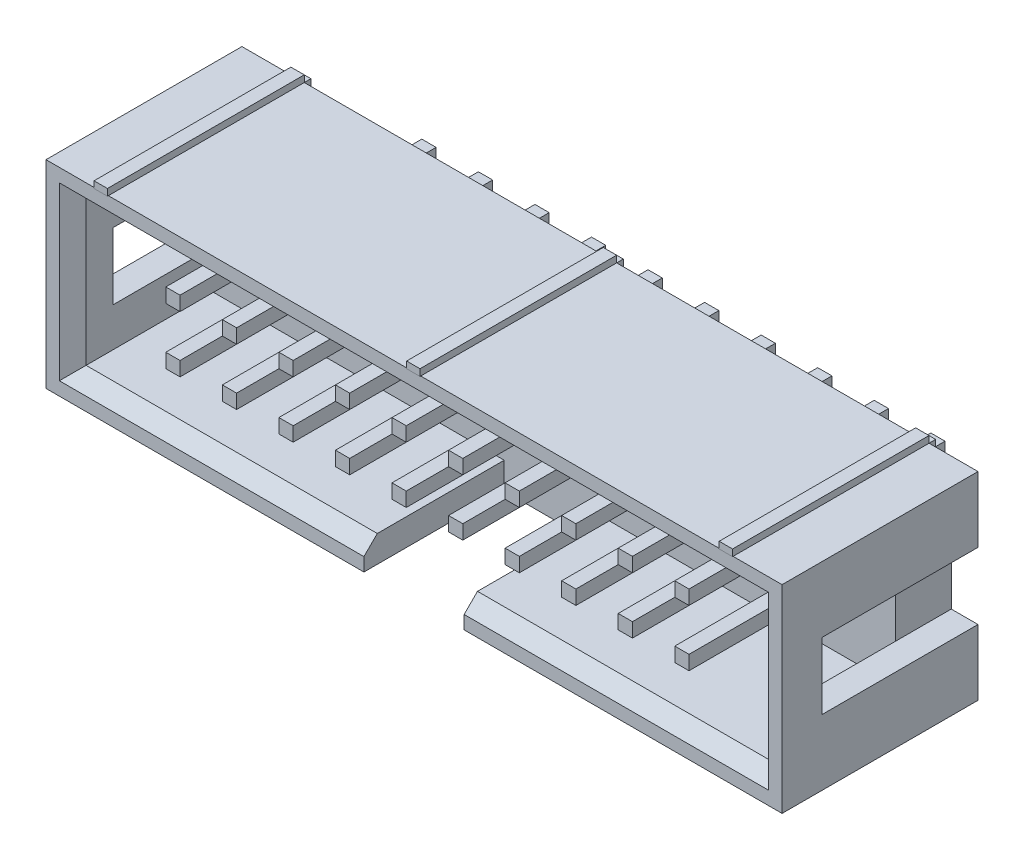
from build123d import *

# Parameters (mm, degrees)
SKETCH_1_W                  = 33.06
SKETCH_1_H                  = 8.9
EXTRUDE_1_DEPTH             = 8.8
SKETCH_2_W                  = 30.66
SKETCH_2_H                  = 6.5
CUT_EXTRUDE_1_DEPTH         = 6.3
SKETCH_7_W                  = 7
SKETCH_7_H                  = 3
CUT_EXTRUDE_2_DEPTH         = 1.2
CUT_EXTRUDE_START           = -33.06
SKETCH_7_2_W                = 7
SKETCH_7_2_H                = 3
CUT_EXTRUDE_5_DEPTH         = 1.2
EXTRUDE_START               = -5.8
SKETCH_3_W                  = 0.64
SKETCH_3_H                  = 0.64
EXTRUDE_2_DEPTH             = 11.5
CUT_EXTRUDE_3_REACH         = 37.35
SKETCH_4_W                  = 4.5
SKETCH_4_H                  = 6.3
SKETCH_5_W                  = 0.6
SKETCH_5_H                  = 8.9
EXTRUDE_4_DEPTH             = 0.3
SKETCH_6_W                  = 0.6
SKETCH_6_H                  = 8.824564604
SKETCH_6_H_2                = 8.832859553
SKETCH_6_H_3                = 8.841681638
EXTRUDE_5_DEPTH             = 0.3
CHAMFER_1_SIZE              = 0.6
PATTERN_LINEAR_1_COUNT      = 10
PATTERN_LINEAR_1_PITCH      = 2.54
PATTERN_LINEAR_1_COUNT_DIR2 = 2
PATTERN_LINEAR_1_PITCH_DIR2 = 2.54


with BuildPart() as part:
    # Эскиз1 → Вытянуть1 (new body)
    with BuildSketch(Plane.XY):
        with Locations((16.53, 4.45)):
            Rectangle(SKETCH_1_W, SKETCH_1_H)
    extrude(amount=EXTRUDE_1_DEPTH)

    # Эскиз2 → Вырез-Вытянуть1 (cut)
    with BuildSketch(Plane.XY.offset(8.8)):
        with Locations((16.53, 4.45)):
            Rectangle(SKETCH_2_W, SKETCH_2_H)
    extrude(amount=-CUT_EXTRUDE_1_DEPTH, mode=Mode.SUBTRACT)

    # Эскиз7 → Вырез-Вытянуть2 (cut)
    with BuildSketch(Plane(origin=(33.06, 0, 0), x_dir=(0, 0, -1), z_dir=(1, 0, 0))):
        with Locations((-3.5, 4.45)):
            Rectangle(SKETCH_7_W, SKETCH_7_H)
    extrude(amount=-CUT_EXTRUDE_2_DEPTH, mode=Mode.SUBTRACT)

    # Эскиз7<2> → Вырез-Вытянуть5 (cut)
    with BuildSketch(Plane(origin=(33.06, 0, 0), x_dir=(0, 0, -1), z_dir=(1, 0, 0)).offset(CUT_EXTRUDE_START)):
        with Locations((-3.5, 4.45)):
            Rectangle(SKETCH_7_2_W, SKETCH_7_2_H)
    extrude(amount=CUT_EXTRUDE_5_DEPTH, mode=Mode.SUBTRACT)

    # Эскиз3 → Вытянуть2 (add)
    with BuildSketch(Plane.XY.offset(2.5).offset(EXTRUDE_START)):
        with Locations((5.1, 5.72)):
            Rectangle(SKETCH_3_W, SKETCH_3_H)
    extrude_2 = extrude(amount=EXTRUDE_2_DEPTH)

    # Эскиз4 → Вытянуть3 (cut, up to next)
    with BuildSketch(Plane.XZ, mode=Mode.PRIVATE) as cut_extrude_3_sk1:
        with Locations((16.53, 5.65)):
            Rectangle(SKETCH_4_W, SKETCH_4_H)
    cut_extrude_3_tool1 = extrude(cut_extrude_3_sk1.sketch, amount=-CUT_EXTRUDE_3_REACH, mode=Mode.PRIVATE) & part.part
    add(cut_extrude_3_tool1.solids().sort_by_distance((16.53, 0, 5.65))[0], mode=Mode.SUBTRACT)

    # Эскиз5 → Вытянуть4 (add)
    with BuildSketch(Plane(origin=(0, 0, 0), x_dir=(-1, 0, 0), z_dir=(0, 0, -1))):
        with Locations((-16.53, 4.45)):
            Rectangle(SKETCH_5_W, SKETCH_5_H)
        with Locations((-30.56, 4.45)):
            Rectangle(SKETCH_5_W, SKETCH_5_H)
        with Locations((-2.5, 4.45)):
            Rectangle(SKETCH_5_W, SKETCH_5_H)
    extrude(amount=EXTRUDE_4_DEPTH)

    # Эскиз6 → Вытянуть5 (add)
    with BuildSketch(Plane(origin=(0, 8.9, 0), x_dir=(1, 0, 0), z_dir=(0, 1, 0))):
        with Locations((30.56, -4.412282302)):
            Rectangle(SKETCH_6_W, SKETCH_6_H)
        with Locations((16.53, -4.416429777)):
            Rectangle(SKETCH_6_W, SKETCH_6_H_2)
        with Locations((2.5, -4.420840819)):
            Rectangle(SKETCH_6_W, SKETCH_6_H_3)
    extrude(amount=EXTRUDE_5_DEPTH)

    # Фаска1
    chamfer_1_edges = [part.edges().sort_by_distance(p)[0] for p in [
        (1.2, 4.45, 8.8),
        (7.74, 1.2, 8.8),
        (31.86, 4.45, 8.8),
        (16.53, 7.7, 8.8),
        (25.32, 1.2, 8.8),
    ]]
    chamfer(chamfer_1_edges, length=CHAMFER_1_SIZE)

    # Линейный массив1: Extrude 2 10 × 2
    with Locations(*[(i * PATTERN_LINEAR_1_PITCH, -j * PATTERN_LINEAR_1_PITCH_DIR2, 0) for i in range(PATTERN_LINEAR_1_COUNT) for j in range(PATTERN_LINEAR_1_COUNT_DIR2) if (i, j) != (0, 0)]):
        add(extrude_2)


solid = part.part
